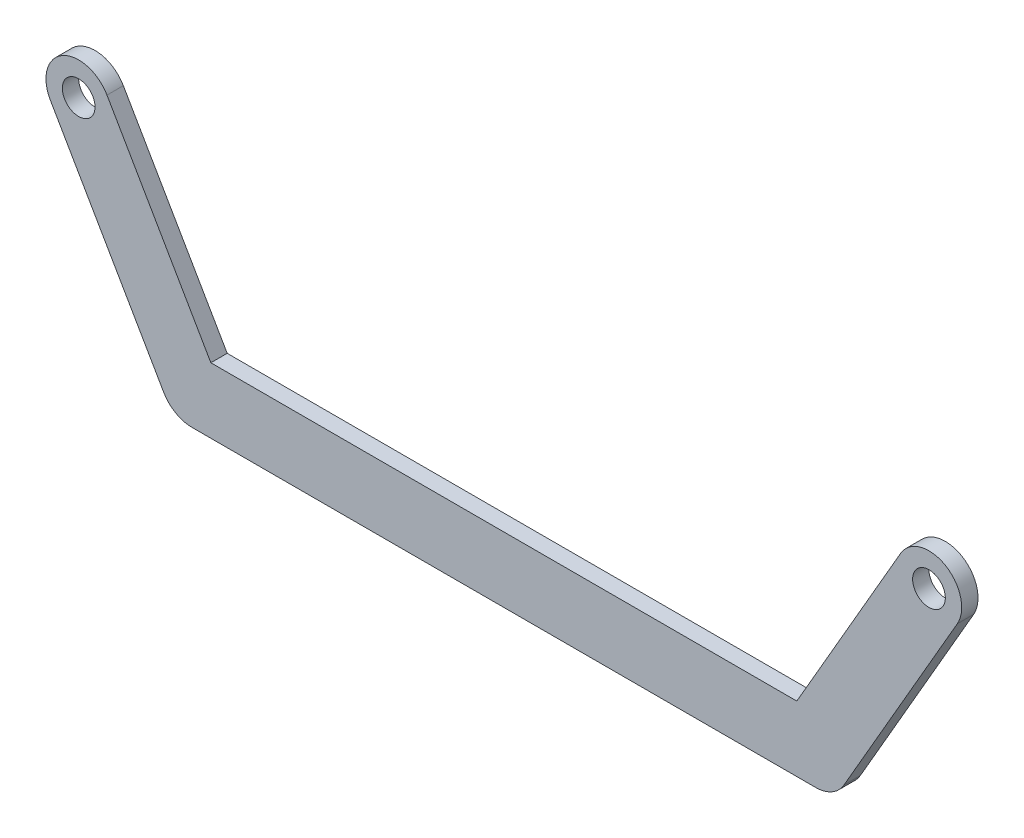
from build123d import *

# Parameters (mm, degrees)
BOSS_EXTRUDE1_DEPTH = 31.75
SKETCH2_R           = 31.75
CUT_EXTRUDE1_DEPTH  = 995.439194974


with BuildPart() as part:
    # Sketch1 → Boss-Extrude1 (new body)
    with BuildSketch(Plane.XY):
        with BuildLine():
            Line((-605.529547439, 63.5), (605.529547439, 63.5))
            ThreePointArc((605.529547439, 63.5), (669.029547439, 0), (605.529547439, -63.5))
            Line((605.529547439, -63.5), (-605.529547439, -63.5))
            ThreePointArc((-605.529547439, -63.5), (-669.029547439, 0), (-605.529547439, 63.5))
        make_face()
        with BuildLine():
            Line((550.536934298, 31.75), (770.50738686, 412.75))
            ThreePointArc((770.50738686, 412.75), (857.25, 435.99261314), (880.49261314, 349.25))
            Line((880.49261314, 349.25), (660.522160579, -31.75))
            ThreePointArc((660.522160579, -31.75), (573.779547439, -54.99261314), (550.536934298, 31.75))
        make_face()
        with BuildLine():
            Line((-660.522160579, -31.75), (-880.49261314, 349.25))
            ThreePointArc((-880.49261314, 349.25), (-857.25, 435.99261314), (-770.50738686, 412.75))
            Line((-770.50738686, 412.75), (-550.536934298, 31.75))
            ThreePointArc((-550.536934298, 31.75), (-573.779547439, -54.99261314), (-660.522160579, -31.75))
        make_face()
    extrude(amount=-BOSS_EXTRUDE1_DEPTH)

    # Sketch2 → Cut-Extrude1 (cut, through all)
    with BuildSketch(Plane.XY):
        with Locations((825.5, 381)):
            Circle(SKETCH2_R)
        with Locations((-825.5, 381)):
            Circle(SKETCH2_R)
    extrude(amount=-CUT_EXTRUDE1_DEPTH, mode=Mode.SUBTRACT)


solid = part.part
